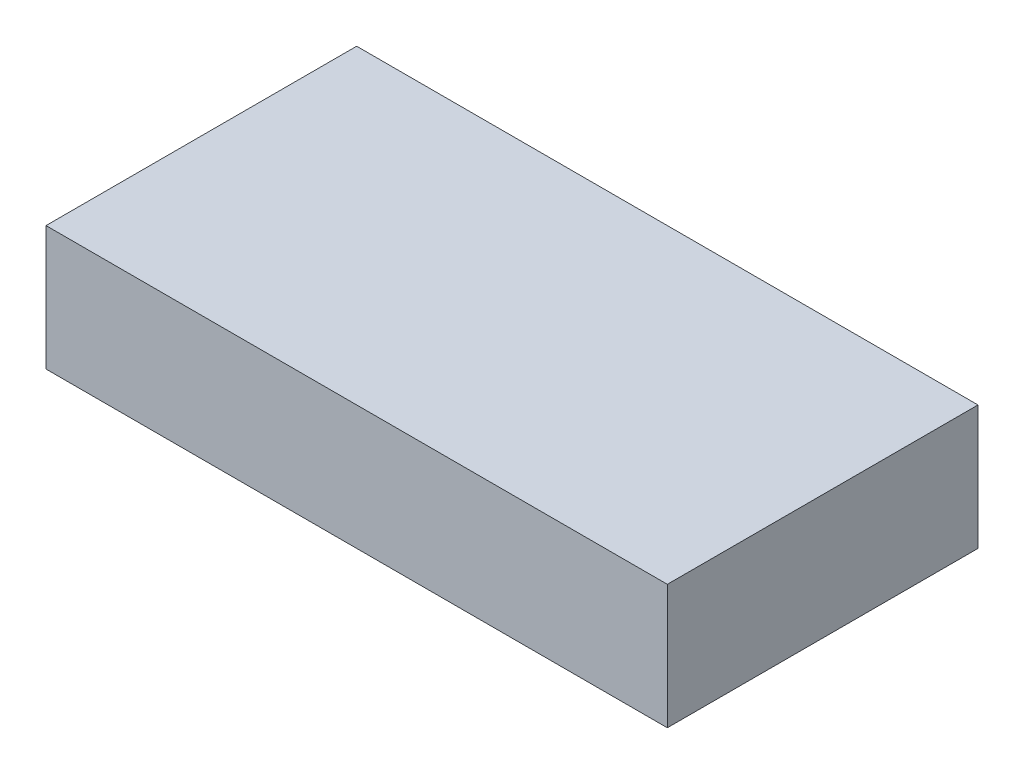
from build123d import *

# Parameters (mm, degrees)
SKETCH1_W           = 16
SKETCH1_H           = 8
BOSS_EXTRUDE1_DEPTH = 3.2
SHELL1_T            = -1.6


with BuildPart() as part:
    # Sketch1 → Boss-Extrude1 (new body)
    with BuildSketch(Plane(origin=(0, 0, 0), x_dir=(1, 0, 0), z_dir=(0, 1, 0))):
        with Locations((8, 4)):
            Rectangle(SKETCH1_W, SKETCH1_H)
    extrude(amount=BOSS_EXTRUDE1_DEPTH)

    # Shell1
    shell1_openings = [part.faces().sort_by_distance(p)[0] for p in [
        (8, 0, -4),
    ]]
    offset(amount=SHELL1_T, openings=shell1_openings, kind=Kind.INTERSECTION)


solid = part.part
